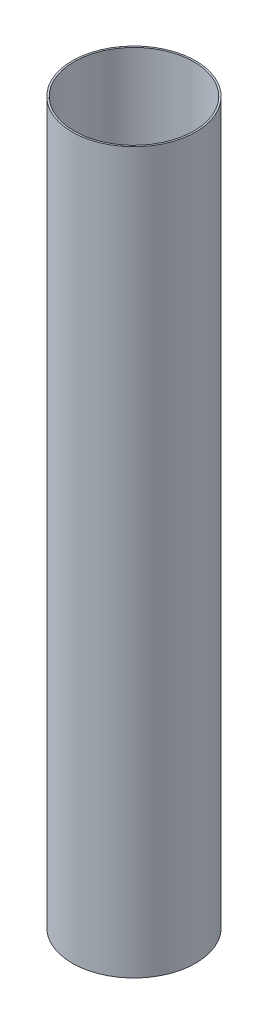
from build123d import *

# Parameters (mm, degrees)
SKETCH1_R           = 78.359
SKETCH1_R_2         = 76.2
BOSS_EXTRUDE1_DEPTH = 914.4


with BuildPart() as part:
    # Sketch1 → Boss-Extrude1 (new body)
    with BuildSketch(Plane(origin=(0, 0, 0), x_dir=(1, 0, 0), z_dir=(0, 1, 0))):
        with Locations(Location((0, 0, 0), (0, 0, 270))):
            Circle(SKETCH1_R)
        with Locations(Location((0, 0, 0), (0, 0, 270))):
            Circle(SKETCH1_R_2, mode=Mode.SUBTRACT)
    extrude(amount=BOSS_EXTRUDE1_DEPTH)


solid = part.part
